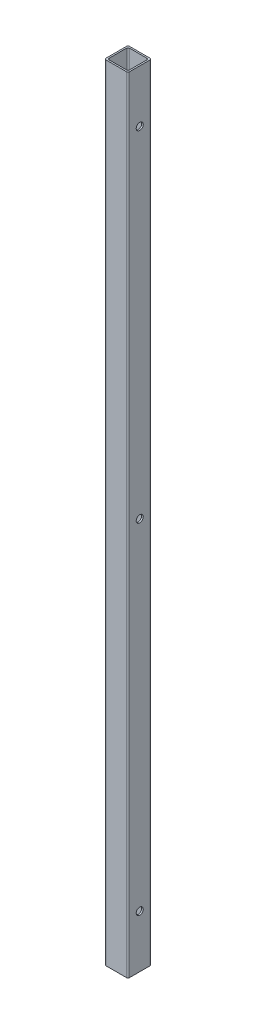
from build123d import *

# Parameters (mm, degrees)
SKETCH1_W                  = 19.304
SKETCH1_H                  = 19.304
SKETCH1_W_2                = 16.764
SKETCH1_H_2                = 16.764
BOSS_EXTRUDE1_DEPTH        = 645.16
FILLET1_R                  = 1.27
F_1_0_228_DIAMETER_HOLE1_D = 5.7912


with BuildPart() as part:
    # Sketch1 → Boss-Extrude1 (new body)
    with BuildSketch(Plane(origin=(0, 0, 0), x_dir=(1, 0, 0), z_dir=(0, 1, 0))):
        Rectangle(SKETCH1_W, SKETCH1_H)
        Rectangle(SKETCH1_W_2, SKETCH1_H_2, mode=Mode.SUBTRACT)
    extrude(amount=BOSS_EXTRUDE1_DEPTH)

    # Fillet1
    fillet1_edges = [part.edges().sort_by_distance(p)[0] for p in [
        (-8.382, 322.58, 8.382),
        (8.382, 322.58, 8.382),
        (8.382, 322.58, -8.382),
        (-8.382, 322.58, -8.382),
        (9.652, 322.58, 9.652),
        (-9.652, 322.58, 9.652),
        (-9.652, 322.58, -9.652),
        (9.652, 322.58, -9.652),
    ]]
    fillet(fillet1_edges, radius=FILLET1_R)

    # #1 (0.228) Diameter Hole1 (through all)
    with Locations(Plane(origin=(9.652, 0, 0), x_dir=(0, 0, -1), z_dir=(1, 0, 0))):
        with Locations((0, 43.18), (0, 601.98), (0, 322.58)):
            Hole(F_1_0_228_DIAMETER_HOLE1_D / 2)


solid = part.part
